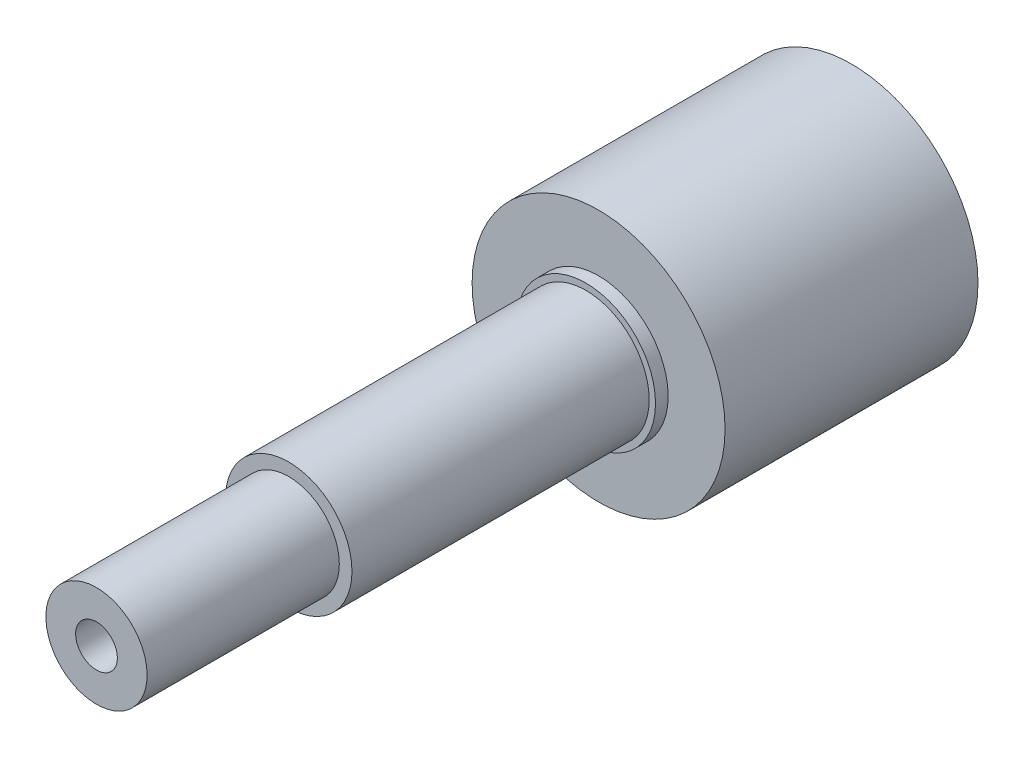
from build123d import *

# Parameters (mm, degrees)
SKETCH_1_R          = 10
EXTRUDE_1_DEPTH     = 20
SKETCH_2_R          = 5
EXTRUDE_2_DEPTH     = 5
SKETCH_4_R          = 5.5
SKETCH_4_R_2        = 5
EXTRUDE_3_DEPTH     = 1
SKETCH_5_R          = 1.65
CUT_EXTRUDE_1_DEPTH = 10
SKETCH_6_R          = 5
EXTRUDE_4_DEPTH     = 35.5
SKETCH_7_OUTSIDE_W  = 35.358
SKETCH_7_OUTSIDE_H  = 35.358
SKETCH_7_OUTSIDE_R  = 4
CUT_EXTRUDE_2_DEPTH = 16
SKETCH_8_R          = 1.65
CUT_EXTRUDE_3_DEPTH = 10
SKETCH_9_R          = 4
CUT_EXTRUDE_4_DEPTH = 0.8


with BuildPart() as part:
    # ｽｹｯﾁ1 → ﾎﾞｽ - 押し出し1 (new body)
    with BuildSketch(Plane.XY):
        Circle(SKETCH_1_R)
    extrude(amount=EXTRUDE_1_DEPTH)

    # ｽｹｯﾁ2 → ﾎﾞｽ - 押し出し2 (add)
    with BuildSketch(Plane.XY.offset(20)):
        Circle(SKETCH_2_R)
    extrude(amount=EXTRUDE_2_DEPTH)

    # ｽｹｯﾁ4 → ﾎﾞｽ - 押し出し3 (add)
    with BuildSketch(Plane.XY.offset(20)):
        Circle(SKETCH_4_R)
        Circle(SKETCH_4_R_2, mode=Mode.SUBTRACT)
    extrude(amount=EXTRUDE_3_DEPTH)

    # ｽｹｯﾁ5 → ｶｯﾄ - 押し出し1 (cut)
    with BuildSketch(Plane(origin=(0, 0, 0), x_dir=(-1, 0, 0), z_dir=(0, 0, -1))):
        with Locations((0, 6)):
            Circle(SKETCH_5_R)
        with Locations(Location((0, -6, 0), (0, 0, 180))):
            Circle(SKETCH_5_R)
    extrude(amount=-CUT_EXTRUDE_1_DEPTH, mode=Mode.SUBTRACT)

    # ｽｹｯﾁ6 → ﾎﾞｽ - 押し出し4 (add)
    with BuildSketch(Plane.XY.offset(25)):
        Circle(SKETCH_6_R)
    extrude(amount=EXTRUDE_4_DEPTH)

    # ｽｹｯﾁ7 outside → ｶｯﾄ - 押し出し2 (cut)
    with BuildSketch(Plane.XY.offset(60.5)):
        Rectangle(SKETCH_7_OUTSIDE_W, SKETCH_7_OUTSIDE_H)
        Circle(SKETCH_7_OUTSIDE_R, mode=Mode.SUBTRACT)
    extrude(amount=-CUT_EXTRUDE_2_DEPTH, mode=Mode.SUBTRACT)

    # ｽｹｯﾁ8 → ｶｯﾄ - 押し出し3 (cut)
    with BuildSketch(Plane.XY.offset(60.5)):
        Circle(SKETCH_8_R)
    extrude(amount=-CUT_EXTRUDE_3_DEPTH, mode=Mode.SUBTRACT)

    # ｽｹｯﾁ9 → ｶｯﾄ - 押し出し4 (cut)
    with BuildSketch(Plane.XY.offset(60.5)):
        Circle(SKETCH_9_R)
    extrude(amount=-CUT_EXTRUDE_4_DEPTH, mode=Mode.SUBTRACT)


solid = part.part
